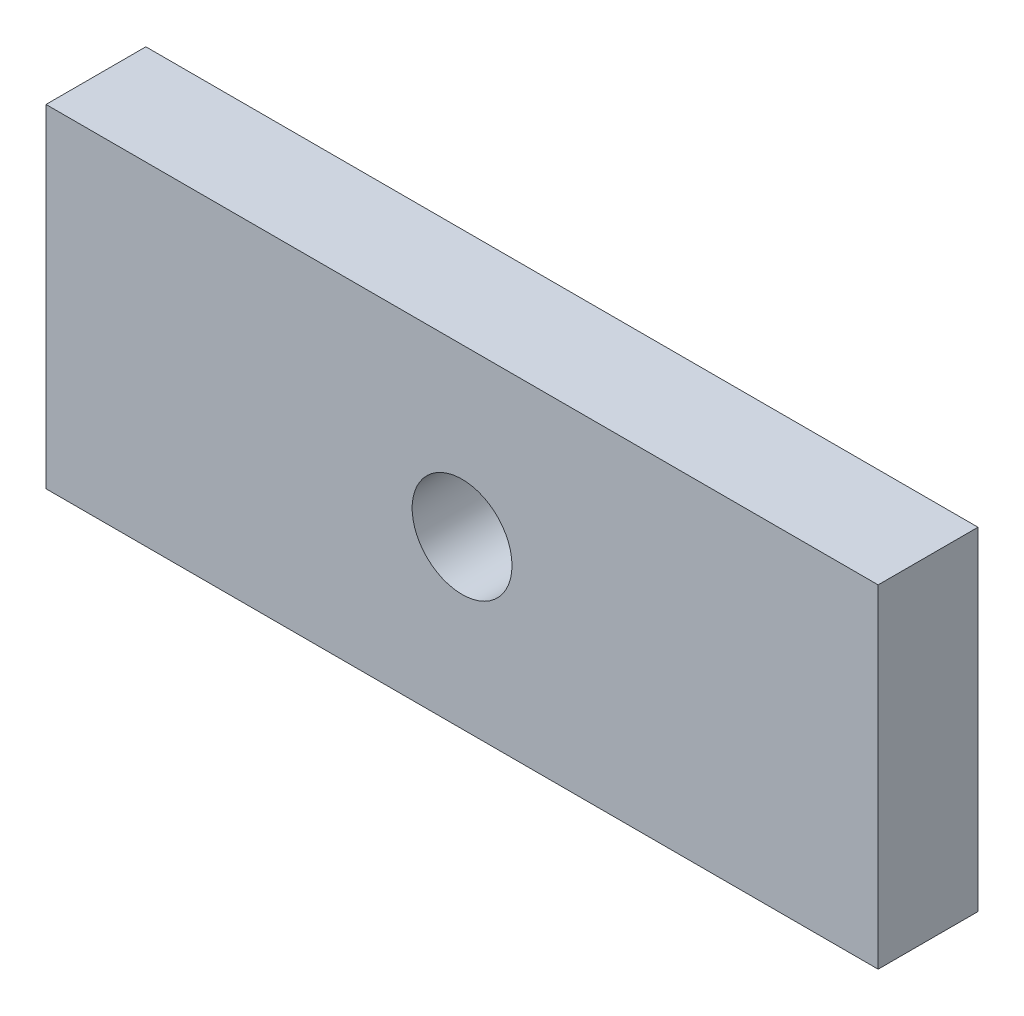
from build123d import *

# Parameters (mm, degrees)
EDRAWING1_W     = 25
EDRAWING1_H     = 10
EDRAWING1_R     = 1.5
EXTRUDE_2_DEPTH = 3


with BuildPart() as part:
    # edrawing1 → extrude 2 (new body)
    with BuildSketch(Plane.XY):
        with Locations((12.5, 5)):
            Rectangle(EDRAWING1_W, EDRAWING1_H)
        with Locations((12.5, 5)):
            Circle(EDRAWING1_R, mode=Mode.SUBTRACT)
    extrude(amount=EXTRUDE_2_DEPTH)


solid = part.part
